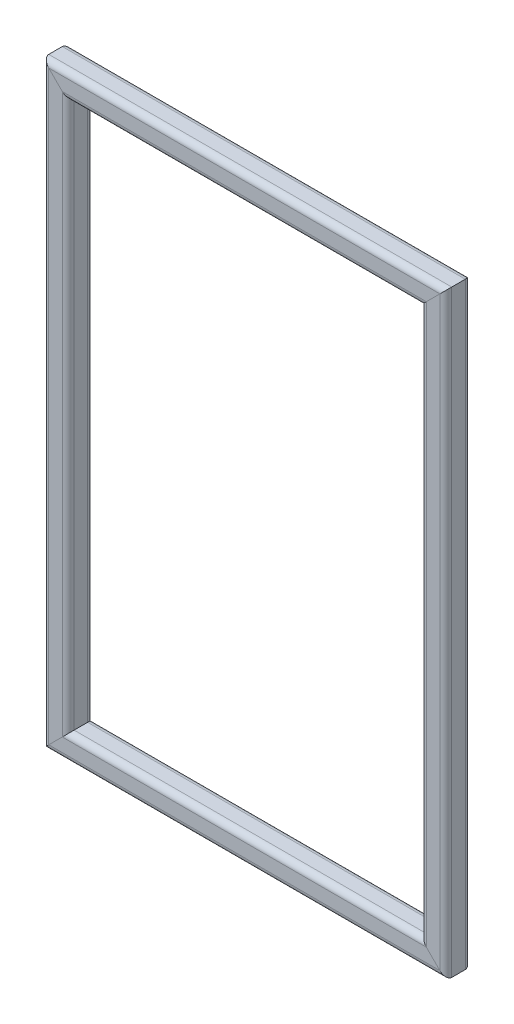
from build123d import *

# Parameters (mm, degrees)
F_30_X_30_X_3_5_1_DEPTH      = 699.213203436
F_30_X_30_X_3_5_1_DEPTH_BACK = 22.213203436
F_30_X_30_X_3_5_1_2_DEPTH    = 490.926406871
F_30_X_30_X_3_5_1_3_DEPTH    = 721.426406871
F_30_X_30_X_3_5_1_4_DEPTH    = 490.926406871


with BuildPart() as part:
    # Sketch1 → 方管 30 X 30 X 3.5(1) (new, two sides: drawn at the far end of the back side and taken through both)
    with BuildSketch(Plane(origin=(-223.25, 338.5, 0), x_dir=(1, 0, 0), z_dir=(0, -1, 0)).offset(-F_30_X_30_X_3_5_1_DEPTH_BACK)):
        with BuildLine():
            Line((-8, -15), (8, -15))
            ThreePointArc((8, -15), (12.949747468, -12.949747468), (15, -8))
            Line((15, -8), (15, 8))
            ThreePointArc((15, 8), (12.949747468, 12.949747468), (8, 15))
            Line((8, 15), (-8, 15))
            ThreePointArc((-8, 15), (-12.949747468, 12.949747468), (-15, 8))
            Line((-15, 8), (-15, -8))
            ThreePointArc((-15, -8), (-12.949747468, -12.949747468), (-8, -15))
        make_face()
        with BuildLine():
            Line((-8, -11.5), (8, -11.5))
            ThreePointArc((8, -11.5), (10.474873734, -10.474873734), (11.5, -8))
            Line((11.5, -8), (11.5, 8))
            ThreePointArc((11.5, 8), (10.474873734, 10.474873734), (8, 11.5))
            Line((8, 11.5), (-8, 11.5))
            ThreePointArc((-8, 11.5), (-10.474873734, 10.474873734), (-11.5, 8))
            Line((-11.5, 8), (-11.5, -8))
            ThreePointArc((-11.5, -8), (-10.474873734, -10.474873734), (-8, -11.5))
        make_face(mode=Mode.SUBTRACT)
    extrude(amount=F_30_X_30_X_3_5_1_DEPTH + F_30_X_30_X_3_5_1_DEPTH_BACK)

    # 方管 30 X 30 X 3.5(1) mitre 1
    split(bisect_by=Plane(origin=(-223.25, 338.5, 0), x_dir=(0.707106781, -0.707106781, 0), z_dir=(-0.707106781, -0.707106781, 0)), keep=Keep.TOP)

    # 方管 30 X 30 X 3.5(1) mitre 2
    split(bisect_by=Plane(origin=(-223.25, -338.5, 0), x_dir=(-0.707106781, -0.707106781, 0), z_dir=(-0.707106781, 0.707106781, 0)), keep=Keep.TOP)


with BuildPart() as body_2:
    # Sketch1 on segment 2 (carried to segment 2) → 30 X 30 X 3.5_1 2 (new body)
    with BuildSketch(Plane(origin=(-245.463203436, -338.5, 0), x_dir=(0, 1, 0), z_dir=(1, 0, 0))):
        with BuildLine():
            Line((-8, -15), (8, -15))
            ThreePointArc((8, -15), (12.949747468, -12.949747468), (15, -8))
            Line((15, -8), (15, 8))
            ThreePointArc((15, 8), (12.949747468, 12.949747468), (8, 15))
            Line((8, 15), (-8, 15))
            ThreePointArc((-8, 15), (-12.949747468, 12.949747468), (-15, 8))
            Line((-15, 8), (-15, -8))
            ThreePointArc((-15, -8), (-12.949747468, -12.949747468), (-8, -15))
        make_face()
        with BuildLine():
            Line((-8, -11.5), (8, -11.5))
            ThreePointArc((8, -11.5), (10.474873734, -10.474873734), (11.5, -8))
            Line((11.5, -8), (11.5, 8))
            ThreePointArc((11.5, 8), (10.474873734, 10.474873734), (8, 11.5))
            Line((8, 11.5), (-8, 11.5))
            ThreePointArc((-8, 11.5), (-10.474873734, 10.474873734), (-11.5, 8))
            Line((-11.5, 8), (-11.5, -8))
            ThreePointArc((-11.5, -8), (-10.474873734, -10.474873734), (-8, -11.5))
        make_face(mode=Mode.SUBTRACT)
    extrude(amount=F_30_X_30_X_3_5_1_2_DEPTH)

    # 30 X 30 X 3.5_1 2 mitre 1
    split(bisect_by=Plane(origin=(-223.25, -338.5, 0), x_dir=(0.707106781, 0.707106781, 0), z_dir=(0.707106781, -0.707106781, 0)), keep=Keep.TOP)

    # 30 X 30 X 3.5_1 2 mitre 2
    split(bisect_by=Plane(origin=(223.25, -338.5, 0), x_dir=(0.707106781, -0.707106781, 0), z_dir=(-0.707106781, -0.707106781, 0)), keep=Keep.TOP)


with BuildPart() as body_3:
    # Sketch1 on segment 3 (carried to segment 3) → 30 X 30 X 3.5_1 3 (new body)
    with BuildSketch(Plane(origin=(223.25, -360.713203436, 0), x_dir=(-1, 0, 0), z_dir=(0, 1, 0))):
        with BuildLine():
            Line((-8, -15), (8, -15))
            ThreePointArc((8, -15), (12.949747468, -12.949747468), (15, -8))
            Line((15, -8), (15, 8))
            ThreePointArc((15, 8), (12.949747468, 12.949747468), (8, 15))
            Line((8, 15), (-8, 15))
            ThreePointArc((-8, 15), (-12.949747468, 12.949747468), (-15, 8))
            Line((-15, 8), (-15, -8))
            ThreePointArc((-15, -8), (-12.949747468, -12.949747468), (-8, -15))
        make_face()
        with BuildLine():
            Line((-8, -11.5), (8, -11.5))
            ThreePointArc((8, -11.5), (10.474873734, -10.474873734), (11.5, -8))
            Line((11.5, -8), (11.5, 8))
            ThreePointArc((11.5, 8), (10.474873734, 10.474873734), (8, 11.5))
            Line((8, 11.5), (-8, 11.5))
            ThreePointArc((-8, 11.5), (-10.474873734, 10.474873734), (-11.5, 8))
            Line((-11.5, 8), (-11.5, -8))
            ThreePointArc((-11.5, -8), (-10.474873734, -10.474873734), (-8, -11.5))
        make_face(mode=Mode.SUBTRACT)
    extrude(amount=F_30_X_30_X_3_5_1_3_DEPTH)

    # 30 X 30 X 3.5_1 3 mitre 1
    split(bisect_by=Plane(origin=(223.25, 338.5, 0), x_dir=(0.707106781, 0.707106781, 0), z_dir=(0.707106781, -0.707106781, 0)), keep=Keep.TOP)

    # 30 X 30 X 3.5_1 3 mitre 2
    split(bisect_by=Plane(origin=(223.25, -338.5, 0), x_dir=(-0.707106781, 0.707106781, 0), z_dir=(0.707106781, 0.707106781, 0)), keep=Keep.TOP)


with BuildPart() as body_4:
    # Sketch1 on segment 4 (carried to segment 4) → 30 X 30 X 3.5_1 4 (new body)
    with BuildSketch(Plane(origin=(245.463203436, 338.5, 0), x_dir=(0, -1, 0), z_dir=(-1, 0, 0))):
        with BuildLine():
            Line((-8, -15), (8, -15))
            ThreePointArc((8, -15), (12.949747468, -12.949747468), (15, -8))
            Line((15, -8), (15, 8))
            ThreePointArc((15, 8), (12.949747468, 12.949747468), (8, 15))
            Line((8, 15), (-8, 15))
            ThreePointArc((-8, 15), (-12.949747468, 12.949747468), (-15, 8))
            Line((-15, 8), (-15, -8))
            ThreePointArc((-15, -8), (-12.949747468, -12.949747468), (-8, -15))
        make_face()
        with BuildLine():
            Line((-8, -11.5), (8, -11.5))
            ThreePointArc((8, -11.5), (10.474873734, -10.474873734), (11.5, -8))
            Line((11.5, -8), (11.5, 8))
            ThreePointArc((11.5, 8), (10.474873734, 10.474873734), (8, 11.5))
            Line((8, 11.5), (-8, 11.5))
            ThreePointArc((-8, 11.5), (-10.474873734, 10.474873734), (-11.5, 8))
            Line((-11.5, 8), (-11.5, -8))
            ThreePointArc((-11.5, -8), (-10.474873734, -10.474873734), (-8, -11.5))
        make_face(mode=Mode.SUBTRACT)
    extrude(amount=F_30_X_30_X_3_5_1_4_DEPTH)

    # 30 X 30 X 3.5_1 4 mitre 1
    split(bisect_by=Plane(origin=(-223.25, 338.5, 0), x_dir=(-0.707106781, 0.707106781, 0), z_dir=(0.707106781, 0.707106781, 0)), keep=Keep.TOP)

    # 30 X 30 X 3.5_1 4 mitre 2
    split(bisect_by=Plane(origin=(223.25, 338.5, 0), x_dir=(-0.707106781, -0.707106781, 0), z_dir=(-0.707106781, 0.707106781, 0)), keep=Keep.TOP)


solid = Compound([part.part, body_2.part, body_3.part, body_4.part])
